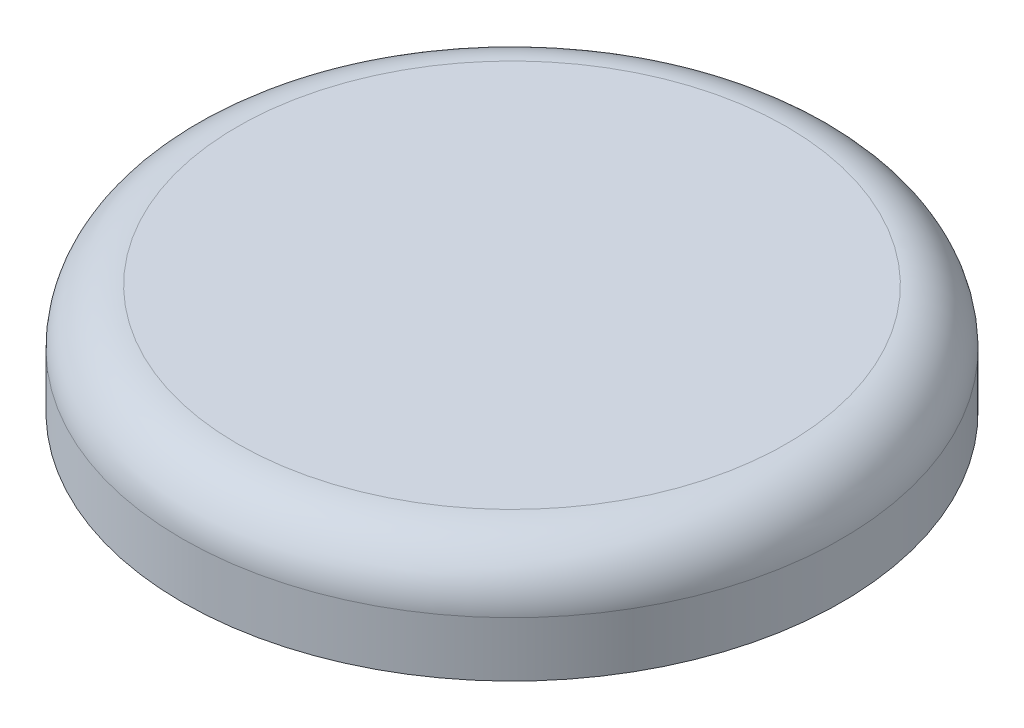
from build123d import *

# Parameters (mm, degrees)
IZIM1_R                     = 60
Y_KSEKLIK_EKSTR_ZYON1_DEPTH = 20
RADYUS1_R                   = 10


with BuildPart() as part:
    # Çizim1 → Yükseklik-Ekstrüzyon1 (new body)
    with BuildSketch(Plane(origin=(0, 0, 0), x_dir=(1, 0, 0), z_dir=(0, 1, 0))):
        with Locations(Location((0, 0, 0), (0, 0, 270))):
            Circle(IZIM1_R)
    extrude(amount=Y_KSEKLIK_EKSTR_ZYON1_DEPTH)

    # Radyus1
    radyus1_edges = [part.edges().sort_by_distance(p)[0] for p in [
        (0, 20, -60),
    ]]
    fillet(radyus1_edges, radius=RADYUS1_R)


solid = part.part
